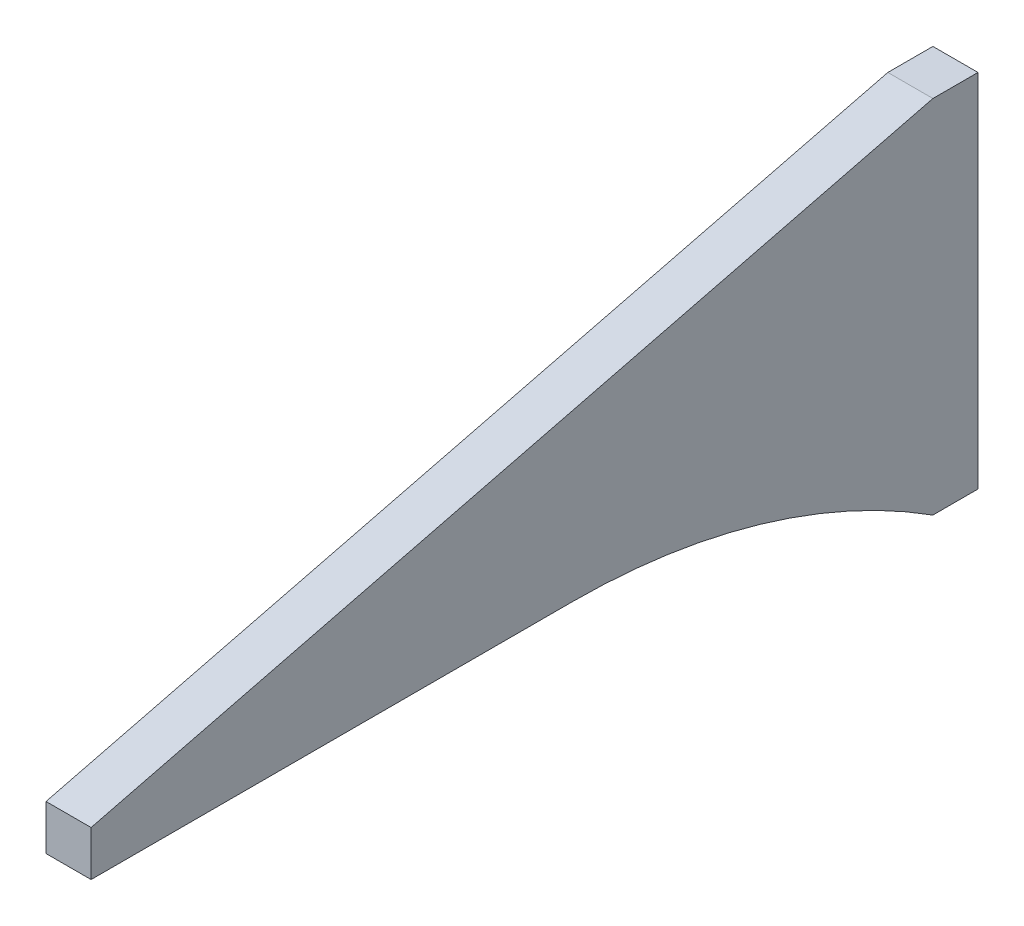
from build123d import *

# Parameters (mm, degrees)
BOSS_EXTRUDE1_DEPTH = 19.05


with BuildPart() as part:
    # Sketch1 → Boss-Extrude1 (new body)
    with BuildSketch(Plane(origin=(0, 0, 0), x_dir=(0, 0, -1), z_dir=(1, 0, 0))):
        with BuildLine():
            Line((0, 0), (203.2, 0))
            ThreePointArc((203.2, 0), (282.575, -11.339285714), (355.6, -44.45))
            Line((355.6, -44.45), (374.65, -44.45))
            Line((374.65, -44.45), (374.65, 107.95))
            Line((374.65, 107.95), (355.6, 107.95))
            Line((355.6, 107.95), (0, 19.05))
            Line((0, 19.05), (0, 0))
        make_face()
    extrude(amount=BOSS_EXTRUDE1_DEPTH)


solid = part.part
